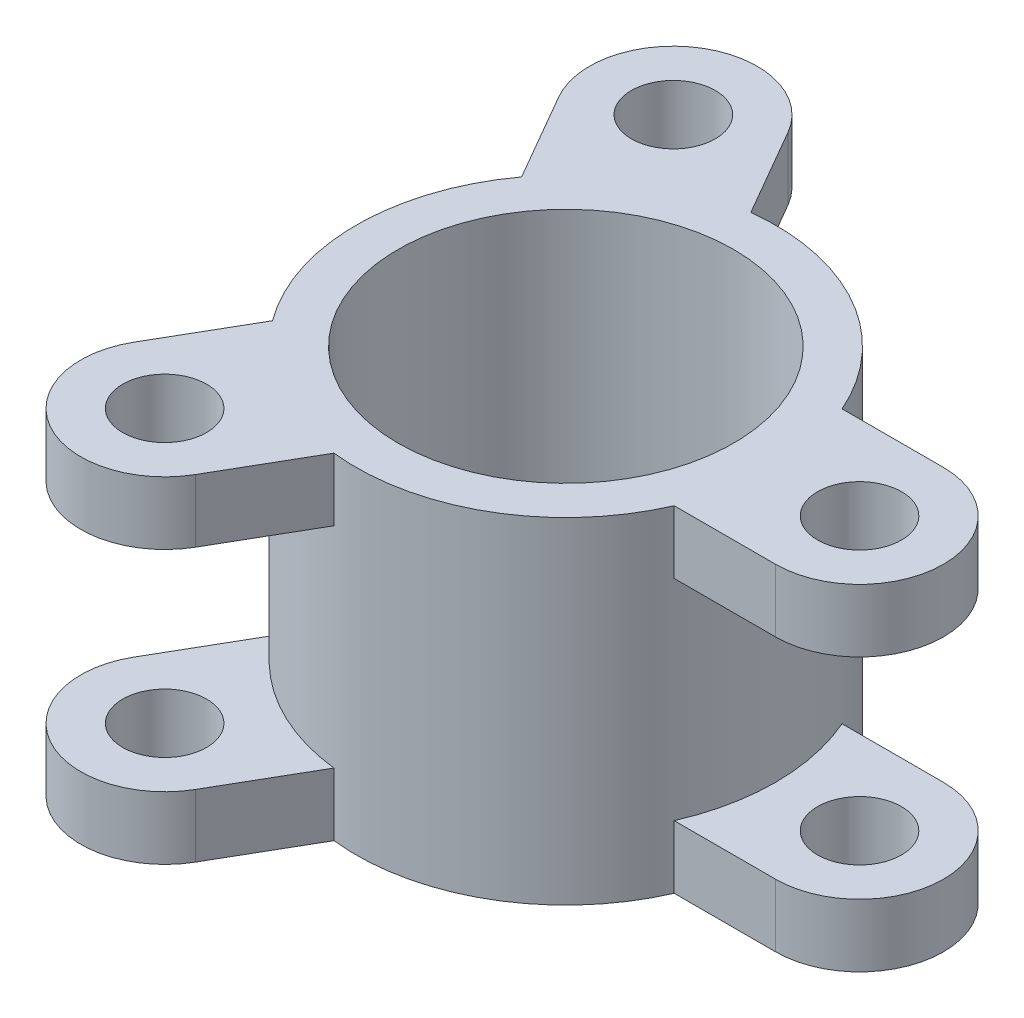
from build123d import *

# Parameters (mm, degrees)
SKETCH1_R           = 40
BOSS_EXTRUDE2_DEPTH = 80
SKETCH1_4_R         = 10
BOSS_EXTRUDE4_DEPTH = 15


with BuildPart() as part:
    # Sketch1 → Boss-Extrude2 (new body)
    with BuildSketch(Plane(origin=(0, 0, 0), x_dir=(1, 0, 0), z_dir=(0, 1, 0))):
        with BuildLine():
            ThreePointArc((50, 0), (48.945315647, 10.215482184), (45.82575695, 20))
            ThreePointArc((45.82575695, 20), (25, 43.301270189), (-5.592370399, 49.686269666))
            ThreePointArc((-5.592370399, 49.686269666), (-25, 43.301270189), (-40.23338655, 29.686269666))
            ThreePointArc((-40.23338655, 29.686269666), (-50, 0), (-40.23338655, -29.686269666))
            ThreePointArc((-40.23338655, -29.686269666), (-25, -43.301270189), (-5.592370399, -49.686269666))
            ThreePointArc((-5.592370399, -49.686269666), (25, -43.301270189), (45.82575695, -20))
            ThreePointArc((45.82575695, -20), (48.945315647, -10.215482184), (50, 0))
        make_face()
        Circle(SKETCH1_R, mode=Mode.SUBTRACT)
    extrude(amount=BOSS_EXTRUDE2_DEPTH)

    # Sketch1<4> → Boss-Extrude4 (add)
    # profile 1 of 3: a face of its own
    with BuildSketch(Plane(origin=(0, 0, 0), x_dir=(1, 0, 0), z_dir=(0, 1, 0))):
        with BuildLine():
            ThreePointArc((70, -20), (90, 0), (70, 20))
            Line((70, 20), (45.82575695, 20))
            ThreePointArc((45.82575695, 20), (50, 0), (45.82575695, -20))
            Line((45.82575695, -20), (70, -20))
        make_face()
        with Locations((70, 0)):
            Circle(SKETCH1_4_R, mode=Mode.SUBTRACT)
    # profile 2 of 3: a face of its own
    with BuildSketch(Plane(origin=(0, 0, 0), x_dir=(1, 0, 0), z_dir=(0, 1, 0))):
        with BuildLine():
            ThreePointArc((-40.23338655, 29.686269666), (-25, 43.301270189), (-5.592370399, 49.686269666))
            Line((-5.592370399, 49.686269666), (-17.679491924, 70.621778265))
            ThreePointArc((-17.679491924, 70.621778265), (-45, 77.942286341), (-52.320508076, 50.621778265))
            Line((-52.320508076, 50.621778265), (-40.23338655, 29.686269666))
        make_face()
        with Locations((-35, 60.621778265)):
            Circle(SKETCH1_4_R, mode=Mode.SUBTRACT)
    # profile 3 of 3: a face of its own
    with BuildSketch(Plane(origin=(0, 0, 0), x_dir=(1, 0, 0), z_dir=(0, 1, 0))):
        with BuildLine():
            Line((-17.679491924, -70.621778265), (-5.592370399, -49.686269666))
            ThreePointArc((-5.592370399, -49.686269666), (-25, -43.301270189), (-40.23338655, -29.686269666))
            Line((-40.23338655, -29.686269666), (-52.320508076, -50.621778265))
            ThreePointArc((-52.320508076, -50.621778265), (-45, -77.942286341), (-17.679491924, -70.621778265))
        make_face()
        with Locations((-35, -60.621778265)):
            Circle(SKETCH1_4_R, mode=Mode.SUBTRACT)
    boss_extrude4 = extrude(amount=BOSS_EXTRUDE4_DEPTH)

    # Mirror1: Boss-Extrude4 across plane
    add(boss_extrude4.mirror(Plane.ZX.offset(40)))


solid = part.part
